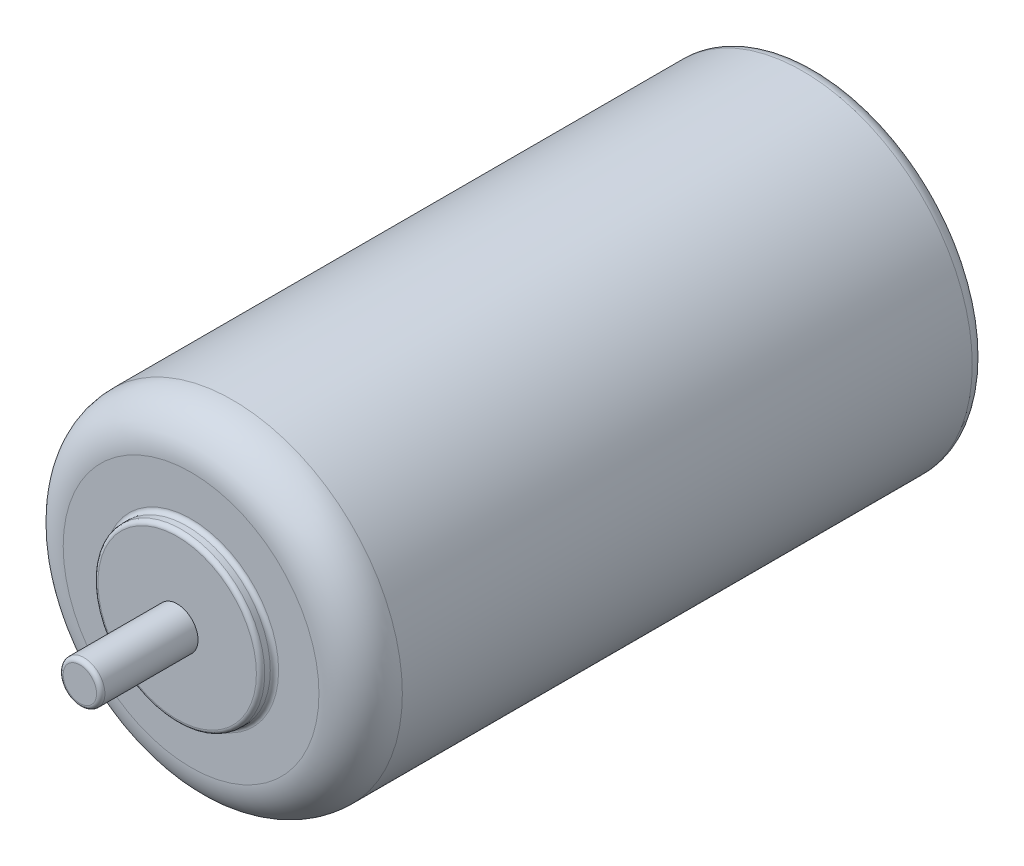
from build123d import *

# Parameters (mm, degrees)
SKETCH1_R           = 12.2
BOSS_EXTRUDE1_DEPTH = 45
SKETCH2_R           = 6
BOSS_EXTRUDE2_DEPTH = 1
SKETCH3_R           = 1.5
BOSS_EXTRUDE3_DEPTH = 8
FILLET1_R           = 3
FILLET2_R           = 1
FILLET3_R           = 0.3
FILLET4_R           = 0.3


with BuildPart() as part:
    # Sketch1 → Boss-Extrude1 (new body)
    with BuildSketch(Plane.XY):
        with Locations(Location((0, 0, 0), (0, 0, 180))):
            Circle(SKETCH1_R)
    extrude(amount=BOSS_EXTRUDE1_DEPTH)

    # Sketch2 → Boss-Extrude2 (add)
    with BuildSketch(Plane.XY.offset(45)):
        Circle(SKETCH2_R)
    extrude(amount=BOSS_EXTRUDE2_DEPTH)

    # Sketch3 → Boss-Extrude3 (add)
    with BuildSketch(Plane.XY.offset(45)):
        Circle(SKETCH3_R)
    extrude(amount=BOSS_EXTRUDE3_DEPTH)

    # Fillet1
    fillet1_edges = [part.edges().sort_by_distance(p)[0] for p in [
        (12.2, 0, 45),
    ]]
    fillet(fillet1_edges, radius=FILLET1_R)

    # Fillet2
    fillet2_edges = [part.edges().sort_by_distance(p)[0] for p in [
        (12.2, 0, 0),
    ]]
    fillet(fillet2_edges, radius=FILLET2_R)

    # Fillet3
    fillet3_edges = [part.edges().sort_by_distance(p)[0] for p in [
        (-6, 0, 45),
        (-6, 0, 46),
    ]]
    fillet(fillet3_edges, radius=FILLET3_R)

    # Fillet4
    fillet4_edges = [part.edges().sort_by_distance(p)[0] for p in [
        (-1.5, 0, 53),
    ]]
    fillet(fillet4_edges, radius=FILLET4_R)


solid = part.part
